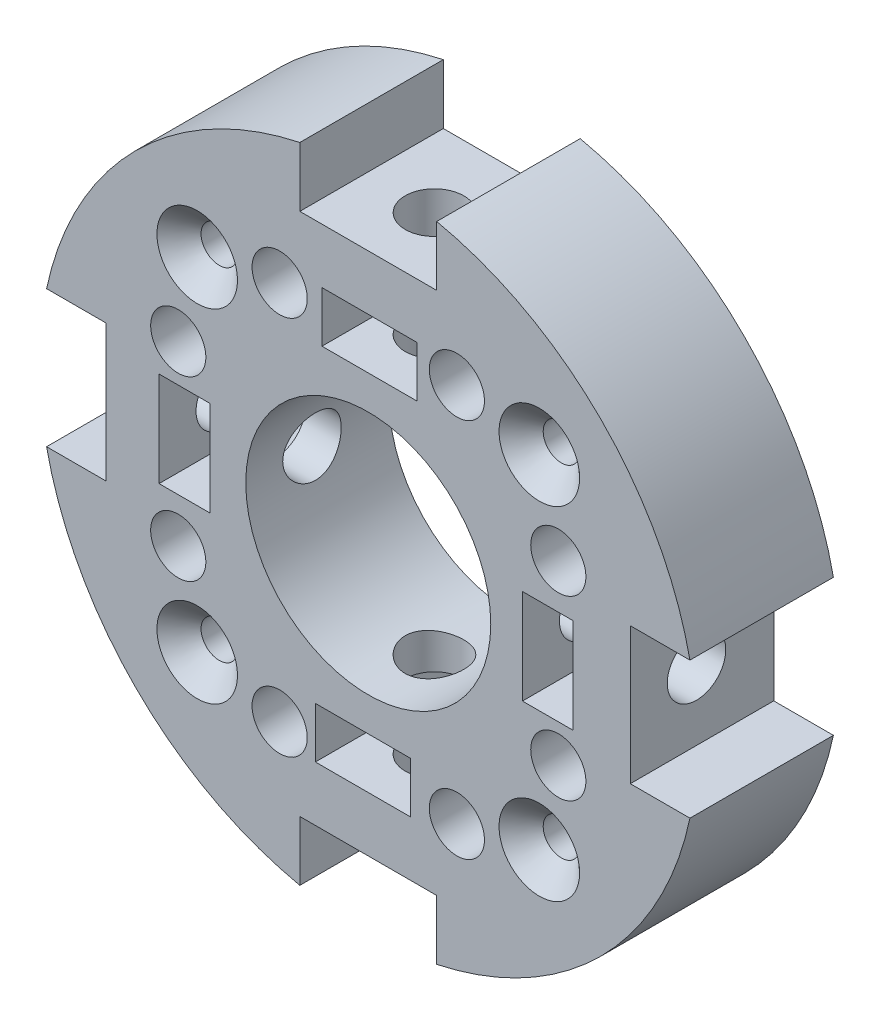
from build123d import *

# Parameters (mm, degrees)
ESQUISSE1_R                         = 11.1
ESQUISSE1_R_2                       = 1.65
ESQUISSE1_R_3                       = 2.5
ESQUISSE1_W                         = 4.6
ESQUISSE1_H                         = 8.6
ESQUISSE1_W_2                       = 8.6
ESQUISSE1_H_2                       = 4.6
BOSS_EXTRU_1_DEPTH                  = 13
CHANFREIN1_SIZE                     = 2
ENL_V_MAT_EXTRU_1_REACH             = 55.956
ESQUISSE2_R                         = 2.65
ENL_V_MAT_EXTRU_1_DIRECTION_2_DEPTH = 54.955560846
R_P_TITION_CIRCULAIRE1_COUNT        = 4


with BuildPart() as part:
    # Esquisse1 → Boss.-Extru.1 (new body)
    with BuildSketch(Plane.XY):
        with BuildLine():
            Line((-23.741352507, -6.2), (-23.741352507, 6.2))
            Line((-23.741352507, 6.2), (-29.147898724, 6.2))
            ThreePointArc((-29.147898724, 6.2), (-21.071782079, 21.071782079), (-6.2, 29.147898724))
            Line((-6.2, 29.147898724), (-6.2, 23.741352507))
            Line((-6.2, 23.741352507), (6.2, 23.741352507))
            Line((6.2, 23.741352507), (6.2, 29.147898724))
            ThreePointArc((6.2, 29.147898724), (21.071782079, 21.071782079), (29.147898724, 6.2))
            Line((29.147898724, 6.2), (23.741352507, 6.2))
            Line((23.741352507, 6.2), (23.741352507, -6.2))
            Line((23.741352507, -6.2), (29.147898724, -6.2))
            ThreePointArc((29.147898724, -6.2), (21.071782079, -21.071782079), (6.2, -29.147898724))
            Line((6.2, -29.147898724), (6.2, -23.741352507))
            Line((6.2, -23.741352507), (-6.2, -23.741352507))
            Line((-6.2, -23.741352507), (-6.2, -29.147898724))
            ThreePointArc((-6.2, -29.147898724), (-21.071782079, -21.071782079), (-29.147898724, -6.2))
            Line((-29.147898724, -6.2), (-23.741352507, -6.2))
        make_face()
        with Locations(Location((0, 0, 0), (0, 0, 180))):
            Circle(ESQUISSE1_R, mode=Mode.SUBTRACT)
        with Locations(Location((-15.5, 15.5, 0), (0, 0, 180))):
            Circle(ESQUISSE1_R_2, mode=Mode.SUBTRACT)
        with Locations(Location((15.5, 15.5, 0), (0, 0, 180))):
            Circle(ESQUISSE1_R_2, mode=Mode.SUBTRACT)
        with Locations(Location((15.5, -15.5, 0), (0, 0, 180))):
            Circle(ESQUISSE1_R_2, mode=Mode.SUBTRACT)
        with Locations(Location((-15.5, -15.5, 0), (0, 0, 180))):
            Circle(ESQUISSE1_R_2, mode=Mode.SUBTRACT)
        with Locations(Location((-8.029746973, 17.219847954, 0), (0, 0, 180))):
            Circle(ESQUISSE1_R_3, mode=Mode.SUBTRACT)
        with Locations(Location((8.029746973, 17.219847954, 0), (0, 0, 180))):
            Circle(ESQUISSE1_R_3, mode=Mode.SUBTRACT)
        with Locations(Location((17.219847954, 8.029746973, 0), (0, 0, 180))):
            Circle(ESQUISSE1_R_3, mode=Mode.SUBTRACT)
        with Locations(Location((17.219847954, -8.029746973, 0), (0, 0, 180))):
            Circle(ESQUISSE1_R_3, mode=Mode.SUBTRACT)
        with Locations(Location((8.029746973, -17.219847954, 0), (0, 0, 180))):
            Circle(ESQUISSE1_R_3, mode=Mode.SUBTRACT)
        with Locations(Location((-8.029746973, -17.219847954, 0), (0, 0, 180))):
            Circle(ESQUISSE1_R_3, mode=Mode.SUBTRACT)
        with Locations(Location((-17.219847954, -8.029746973, 0), (0, 0, 180))):
            Circle(ESQUISSE1_R_3, mode=Mode.SUBTRACT)
        with Locations(Location((-17.219847954, 8.029746973, 0), (0, 0, 180))):
            Circle(ESQUISSE1_R_3, mode=Mode.SUBTRACT)
        with Locations((-16.656153343, 0.3)):
            Rectangle(ESQUISSE1_W, ESQUISSE1_H, mode=Mode.SUBTRACT)
        with Locations((0.106768766, 16.462922109)):
            Rectangle(ESQUISSE1_W_2, ESQUISSE1_H_2, mode=Mode.SUBTRACT)
        with Locations((16.269690876, -0.3)):
            Rectangle(ESQUISSE1_W, ESQUISSE1_H, mode=Mode.SUBTRACT)
        with Locations((-0.493231234, -16.462922109)):
            Rectangle(ESQUISSE1_W_2, ESQUISSE1_H_2, mode=Mode.SUBTRACT)
    extrude(amount=BOSS_EXTRU_1_DEPTH)

    # Chanfrein1
    chanfrein1_edges = [part.edges().sort_by_distance(p)[0] for p in [
        (-13.85, 15.5, 13),
        (17.15, 15.5, 13),
        (17.15, -15.5, 13),
        (-13.85, -15.5, 13),
    ]]
    chamfer(chanfrein1_edges, length=CHANFREIN1_SIZE)

    # Esquisse2 → Enlèv. mat.-Extru.1 (cut, up to next)
    with BuildSketch(Plane.ZY.offset(14.356153343), mode=Mode.PRIVATE) as enl_v_mat_extru_1_sk1:
        with Locations(Location((7, 0, 0), (0, 0, 180))):
            Circle(ESQUISSE2_R)
    enl_v_mat_extru_1_tool1 = extrude(enl_v_mat_extru_1_sk1.sketch, amount=-ENL_V_MAT_EXTRU_1_REACH, mode=Mode.PRIVATE) & part.part
    enl_v_mat_extru_1 = enl_v_mat_extru_1_tool1.solids().sort_by_distance((-14.356153, 0, 7))[0]
    add(enl_v_mat_extru_1, mode=Mode.SUBTRACT)

    # Esquisse2 → Enlèv. mat.-Extru.1 direction 2 (cut)
    with BuildSketch(Plane.ZY.offset(14.356153343)):
        with Locations(Location((7, 0, 0), (0, 0, 180))):
            Circle(ESQUISSE2_R)
    enl_v_mat_extru_1_direction_2 = extrude(amount=ENL_V_MAT_EXTRU_1_DIRECTION_2_DEPTH, mode=Mode.SUBTRACT)

    # Répétition circulaire1: Enlèv. mat.-Extru.1, Enlèv. mat.-Extru.1 direction 2 ×4 about axis
    r_p_tition_circulaire1_axis = Axis((0, 0, 0), (0, 0, -1))
    add([enl_v_mat_extru_1.rotate(r_p_tition_circulaire1_axis, i * 360 / R_P_TITION_CIRCULAIRE1_COUNT) for i in range(1, R_P_TITION_CIRCULAIRE1_COUNT)], mode=Mode.SUBTRACT)
    add([enl_v_mat_extru_1_direction_2.rotate(r_p_tition_circulaire1_axis, i * 360 / R_P_TITION_CIRCULAIRE1_COUNT) for i in range(1, R_P_TITION_CIRCULAIRE1_COUNT)], mode=Mode.SUBTRACT)


solid = part.part
